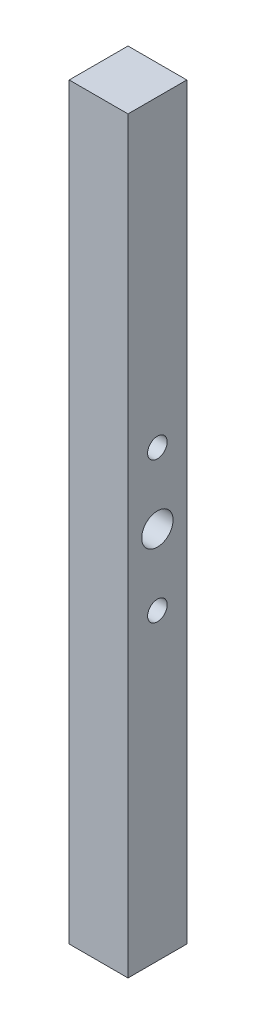
from build123d import *

# Parameters (mm, degrees)
SKETCH_1_W          = 15
SKETCH_1_H          = 15
EXTRUDE_1_DEPTH     = 190.88
SKETCH_2_R          = 4
SKETCH_2_R_2        = 2.5
CUT_EXTRUDE_1_DEPTH = 192.615303147


with BuildPart() as part:
    # 草图1 → 凸台-拉伸1 (new body)
    with BuildSketch(Plane(origin=(0, 0, 0), x_dir=(1, 0, 0), z_dir=(0, 1, 0))):
        Rectangle(SKETCH_1_W, SKETCH_1_H)
    extrude(amount=EXTRUDE_1_DEPTH)

    # 草图2 → 切除-拉伸1 (cut, through all)
    with BuildSketch(Plane(origin=(7.5, 0, 0), x_dir=(0, 0, -1), z_dir=(1, 0, 0))):
        with Locations((0, 95.44)):
            Circle(SKETCH_2_R)
        with Locations((0, 113.44)):
            Circle(SKETCH_2_R_2)
        with Locations((0, 77.44)):
            Circle(SKETCH_2_R_2)
    extrude(amount=-CUT_EXTRUDE_1_DEPTH, mode=Mode.SUBTRACT)


solid = part.part
